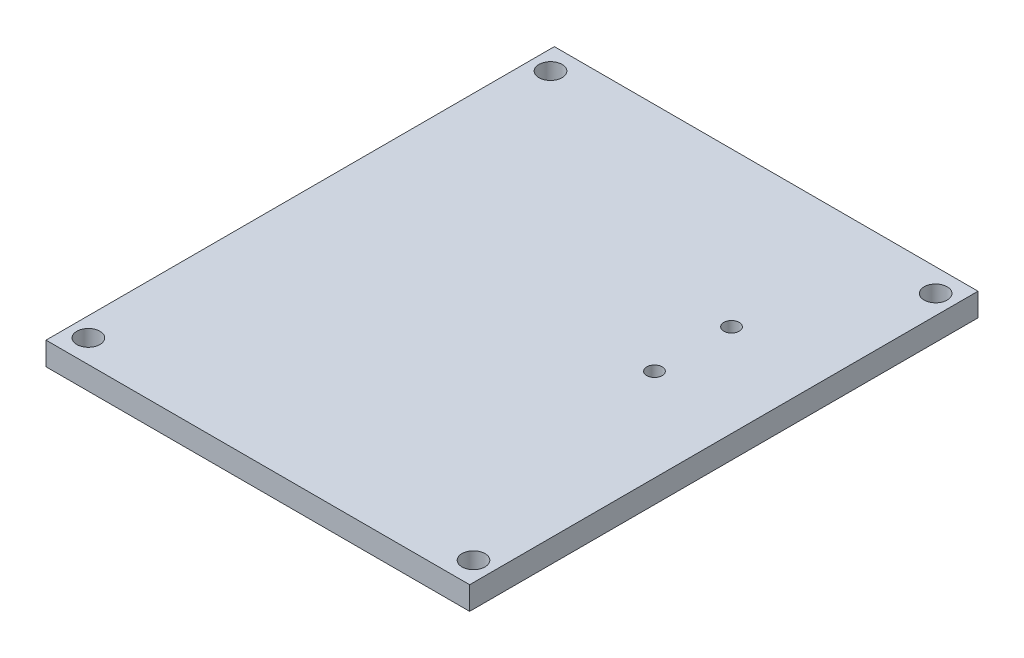
from build123d import *

# Parameters (mm, degrees)
ESQUISSE1_W        = 55
ESQUISSE1_H        = 66
ESQUISSE1_R        = 1.5
ESQUISSE1_R_2      = 1
BOSS_EXTRU_1_DEPTH = 3


with BuildPart() as part:
    # Esquisse1 → Boss.-Extru.1 (new body)
    with BuildSketch(Plane(origin=(0, 0, 0), x_dir=(1, 0, 0), z_dir=(0, 1, 0))):
        with Locations((-0.039557044, -0.082747187)):
            Rectangle(ESQUISSE1_W, ESQUISSE1_H)
        with Locations(Location((-25.039557044, 29.917252813, 0), (0, 0, 270))):
            Circle(ESQUISSE1_R, mode=Mode.SUBTRACT)
        with Locations(Location((24.960442956, 29.917252813, 0), (0, 0, 270))):
            Circle(ESQUISSE1_R, mode=Mode.SUBTRACT)
        with Locations(Location((24.960442956, -30.082747187, 0), (0, 0, 270))):
            Circle(ESQUISSE1_R, mode=Mode.SUBTRACT)
        with Locations(Location((-25.039557044, -30.082747187, 0), (0, 0, 270))):
            Circle(ESQUISSE1_R, mode=Mode.SUBTRACT)
        with Locations(Location((15.460442956, 12.917252813, 0), (0, 0, 270))):
            Circle(ESQUISSE1_R_2, mode=Mode.SUBTRACT)
        with Locations(Location((15.460442956, 2.917252813, 0), (0, 0, 270))):
            Circle(ESQUISSE1_R_2, mode=Mode.SUBTRACT)
    extrude(amount=BOSS_EXTRU_1_DEPTH)


solid = part.part
